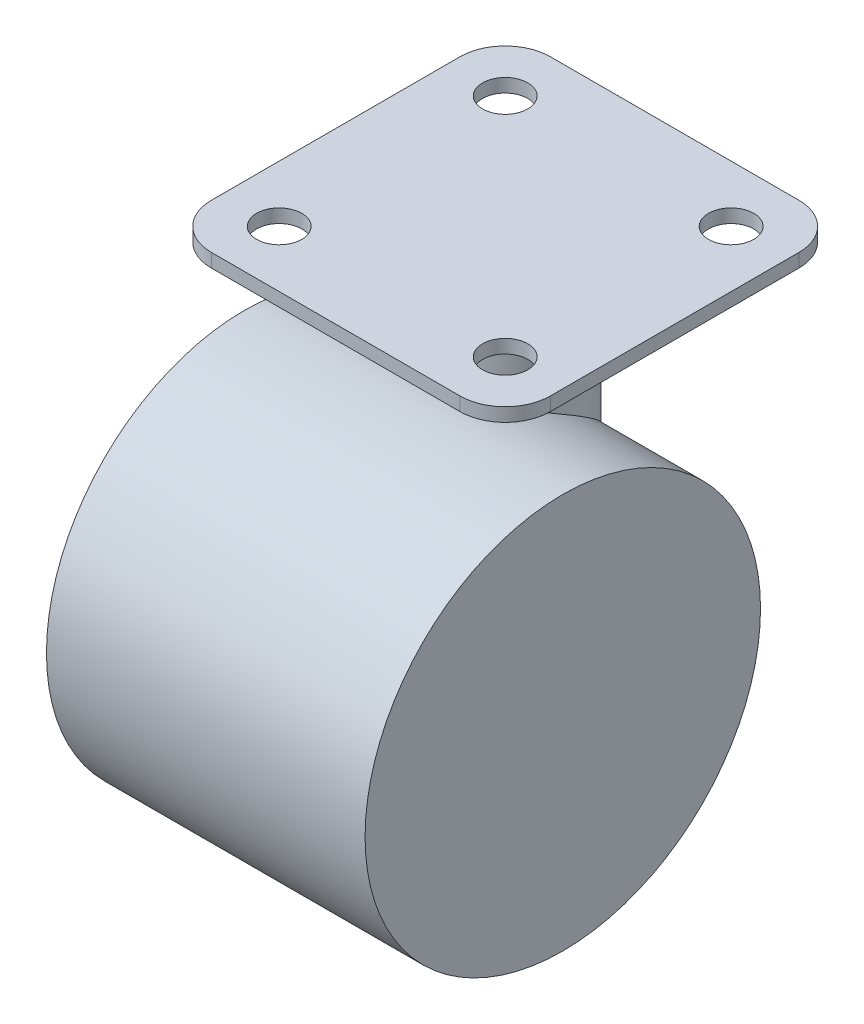
from build123d import *

# Parameters (mm, degrees)
SKETCH_1_W              = 30
SKETCH_1_H              = 30
EXTRUDE_401_DEPTH       = 0.6
SKETCH_7_R              = 2
CUT_EXTRUDE_589_DEPTH   = 22.247117452
FILLET_4_R              = 4
SKETCH_9_R              = 17.5
EXTRUDE_963_DEPTH       = 14.1
EXTRUDE_1165_REACH      = 54.527
EXTRUDE_1165_END_RADIUS = 17.5
SKETCH_8_R              = 6


with BuildPart() as part:
    # Эскиз1 → Extrude 401 (new, symmetric)
    with BuildSketch(Plane(origin=(0, 0, 0), x_dir=(1, 0, 0), z_dir=(0, 1, 0))):
        Rectangle(SKETCH_1_W, SKETCH_1_H)
    extrude(amount=EXTRUDE_401_DEPTH, both=True)

    # Эскиз7 → Cut-Extrude 589 (cut, through all)
    with BuildSketch(Plane(origin=(0, 0.6, 0), x_dir=(1, 0, 0), z_dir=(0, 1, 0))):
        with Locations(Location((-10, 10, 0), (0, 0, 270))):
            Circle(SKETCH_7_R)
        with Locations(Location((10, 10, 0), (0, 0, 270))):
            Circle(SKETCH_7_R)
        with Locations(Location((10, -10, 0), (0, 0, 270))):
            Circle(SKETCH_7_R)
        with Locations(Location((-10, -10, 0), (0, 0, 270))):
            Circle(SKETCH_7_R)
    extrude(amount=-CUT_EXTRUDE_589_DEPTH, mode=Mode.SUBTRACT)

    # Скругление4
    fillet_4_edges = [part.edges().sort_by_distance(p)[0] for p in [
        (15, 0, 15),
        (-15, 0, 15),
        (-15, 0, -15),
        (15, 0, -15),
    ]]
    fillet(fillet_4_edges, radius=FILLET_4_R)

    # Extrude 1165: up to this cylinder (the profile starts outside it)
    extrude_1165_end = Plane(origin=(0, -25.9, 9), z_dir=(-1, 0, 0)) * Cylinder(EXTRUDE_1165_END_RADIUS, 145.054, mode=Mode.PRIVATE)
    # Эскиз8 → Extrude 1165 (add, up to the surface)
    with BuildSketch(Plane.XZ.offset(0.6), mode=Mode.PRIVATE) as extrude_1165_sk1:
        with Locations(Location((0, 0, 0), (0, 0, 90))):
            Circle(SKETCH_8_R)
    extrude_1165_tool1 = extrude(extrude_1165_sk1.sketch, amount=EXTRUDE_1165_REACH, mode=Mode.PRIVATE) - extrude_1165_end
    add(extrude_1165_tool1.solids().sort_by_distance((0, -0.6, 0))[0])


with BuildPart() as body_2:
    # Эскиз9 → Extrude 963 (new, symmetric)
    with BuildSketch(Plane(origin=(0, 0, 0), x_dir=(0, 0, -1), z_dir=(1, 0, 0))):
        with Locations((-9, -25.9)):
            Circle(SKETCH_9_R)
    extrude(amount=EXTRUDE_963_DEPTH, both=True)


solid = Compound([part.part, body_2.part])
